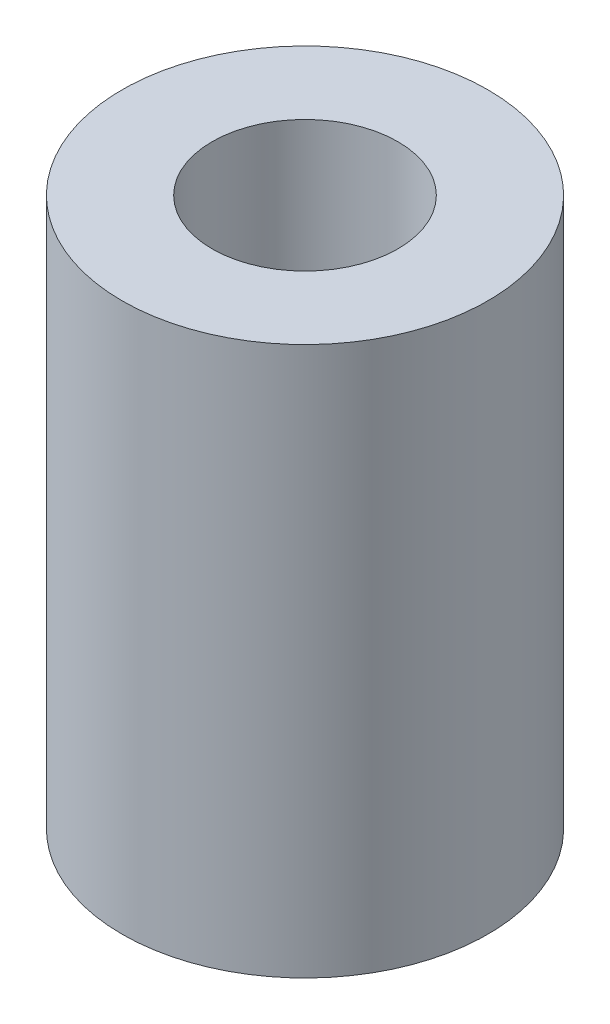
from build123d import *

# Parameters (mm, degrees)
SKETCH_1_R      = 5
SKETCH_1_R_2    = 2.54
EXTRUDE_1_DEPTH = 15


with BuildPart() as part:
    # 草图1 → 凸台-拉伸1 (new body)
    with BuildSketch(Plane(origin=(0, 0, 0), x_dir=(1, 0, 0), z_dir=(0, 1, 0))):
        with Locations(Location((0, 0, 0), (0, 0, 270))):
            Circle(SKETCH_1_R)
        with Locations(Location((0, 0, 0), (0, 0, 270))):
            Circle(SKETCH_1_R_2, mode=Mode.SUBTRACT)
    extrude(amount=EXTRUDE_1_DEPTH)


solid = part.part
